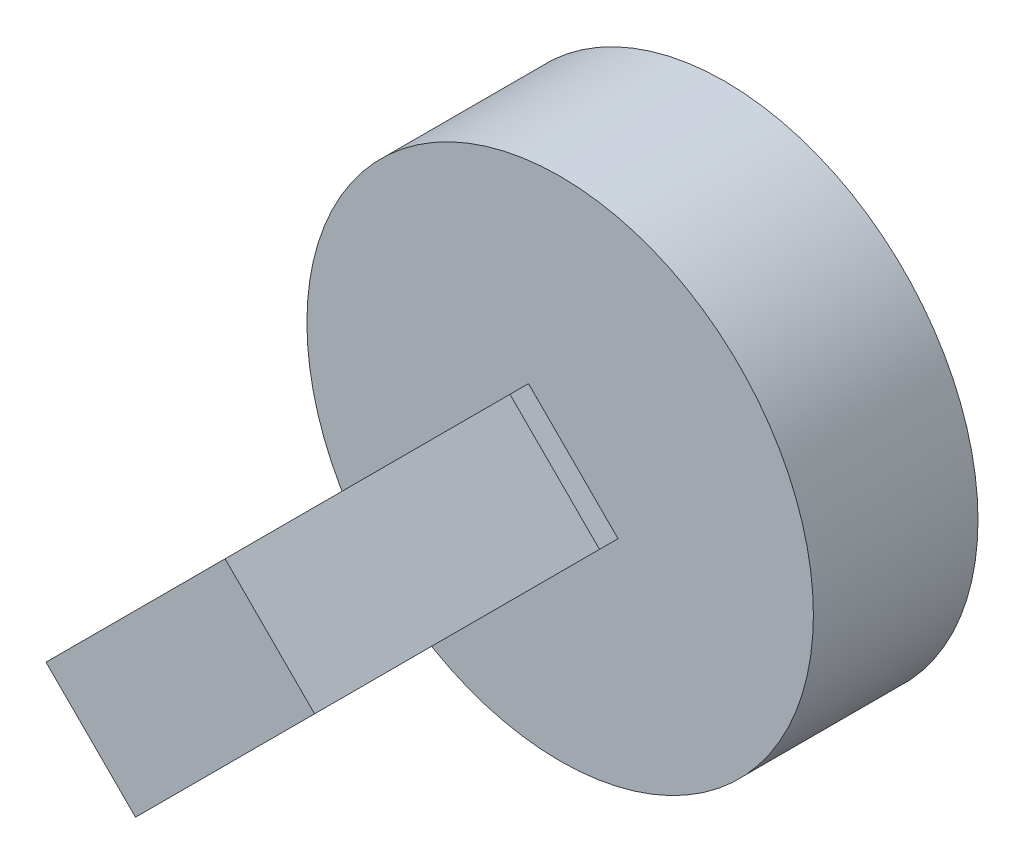
from build123d import *

# Parameters (mm, degrees)
SKETCH_1_R      = 40
EXTRUDE_1_DEPTH = 26
SKETCH_2_R      = 1.5
EXTRUDE_2_DEPTH = 5
EXTRUDE_3_DEPTH = 10
EXTRUDE_4_DEPTH = 45


with BuildPart() as part:
    # 草图1 → 凸台-拉伸1 (new body)
    with BuildSketch(Plane.XY):
        with Locations(Location((0, 0, 0), (0, 0, 180))):
            Circle(SKETCH_1_R)
    extrude(amount=EXTRUDE_1_DEPTH)

    # 草图2 → 凸台-拉伸2 (add)
    with BuildSketch(Plane.XY.offset(26)):
        Circle(SKETCH_2_R)
    extrude(amount=EXTRUDE_2_DEPTH)

    # 草图3 → 凸台-拉伸3 (add)
    with BuildSketch(Plane.XY.offset(31)):
        Polygon((0, 14.14), (14.14, 0), (0, -14.14), (-14.14, 0), align=None)
    extrude(amount=EXTRUDE_3_DEPTH)

    # 草图5 → 凸台-拉伸4 (add)
    with BuildSketch(Plane.XY.offset(41)):
        Polygon((0, -14.14), (-14.14, 0), (-21.213203436, -7.073203436), (-7.073203436, -21.213203436), align=None)
        Polygon((7.073203436, 21.213203436), (0, 14.14), (14.14, 0), (21.213203436, 7.073203436), align=None)
        Polygon((14.14, 0), (0, 14.14), (-14.14, 0), (0, -14.14), align=None)
    extrude(amount=EXTRUDE_4_DEPTH)


solid = part.part
